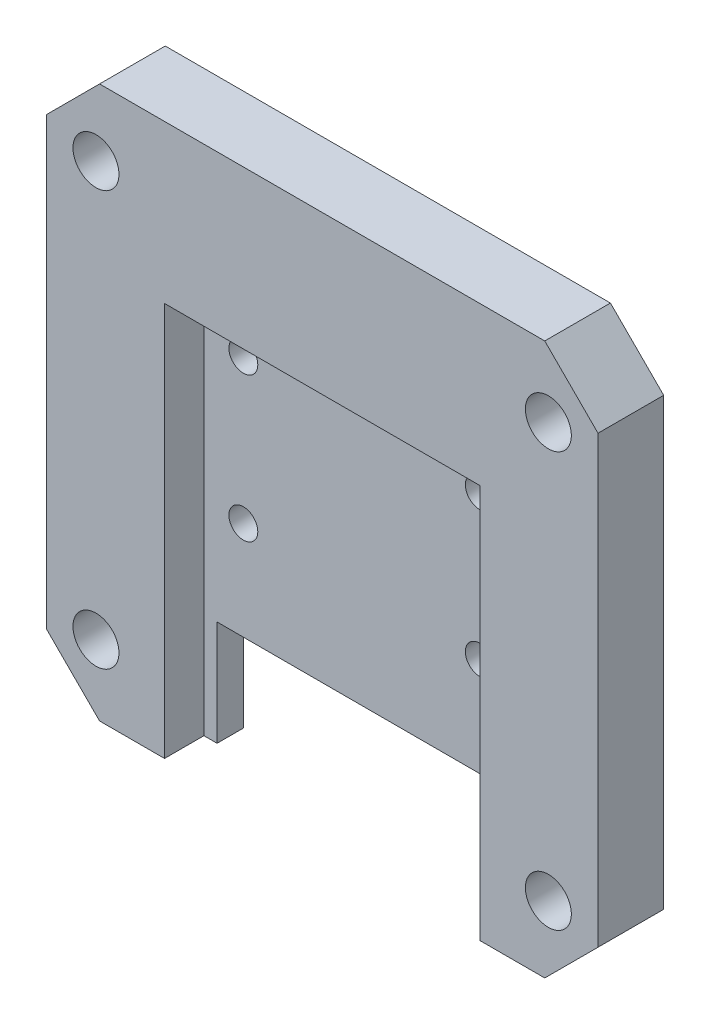
from build123d import *

# Parameters (mm, degrees)
SKETCH1_R               = 1.75
BOSS_EXTRUDE1_DEPTH     = 5
CUT_EXTRUDE1_DEPTH      = 60.607046563
CUT_EXTRUDE1_DEPTH_BACK = 60.607046563
SKETCH2_W               = 22
SKETCH2_H               = 8
SKETCH3_W               = 24
SKETCH3_H               = 30
CUT_EXTRUDE2_DEPTH      = 3
SKETCH4_R               = 1.1
CUT_EXTRUDE3_DEPTH      = 3


with BuildPart() as part:
    # Sketch1 → Boss-Extrude1 (new body)
    with BuildSketch(Plane.XY):
        Polygon((4.055, 42), (0, 37.945), (0, 4.055), (4.055, 0), (37.945, 0), (42, 4.055), (42, 37.945), (37.945, 42), align=None)
        with Locations((3.779747468, 36.775)):
            Circle(SKETCH1_R, mode=Mode.SUBTRACT)
        with Locations((3.779747468, 5.225)):
            Circle(SKETCH1_R, mode=Mode.SUBTRACT)
        with Locations(Location((38.220252532, 5.225, 0), (0, 0, 180))):
            Circle(SKETCH1_R, mode=Mode.SUBTRACT)
        with Locations(Location((38.220252532, 36.775, 0), (0, 0, 180))):
            Circle(SKETCH1_R, mode=Mode.SUBTRACT)
    extrude(amount=BOSS_EXTRUDE1_DEPTH)

    # Sketch2 → Cut-Extrude1 (cut, two sides: drawn at the far end of the back side and taken through both)
    with BuildSketch(Plane.XY.offset(5).offset(-CUT_EXTRUDE1_DEPTH_BACK)):
        with Locations((21, 4)):
            Rectangle(SKETCH2_W, SKETCH2_H)
    extrude(amount=CUT_EXTRUDE1_DEPTH + CUT_EXTRUDE1_DEPTH_BACK, mode=Mode.SUBTRACT)

    # Sketch3 → Cut-Extrude2 (cut)
    with BuildSketch(Plane.XY.offset(5)):
        with Locations((21, 15)):
            Rectangle(SKETCH3_W, SKETCH3_H)
    extrude(amount=-CUT_EXTRUDE2_DEPTH, mode=Mode.SUBTRACT)

    # Sketch4 → Cut-Extrude3 (cut)
    with BuildSketch(Plane.XY.offset(2)):
        with Locations((12, 26.5)):
            Circle(SKETCH4_R)
        with Locations((30, 26.5)):
            Circle(SKETCH4_R)
        with Locations((12, 15.5)):
            Circle(SKETCH4_R)
        with Locations((30, 15.5)):
            Circle(SKETCH4_R)
    extrude(amount=-CUT_EXTRUDE3_DEPTH, mode=Mode.SUBTRACT)


solid = part.part
